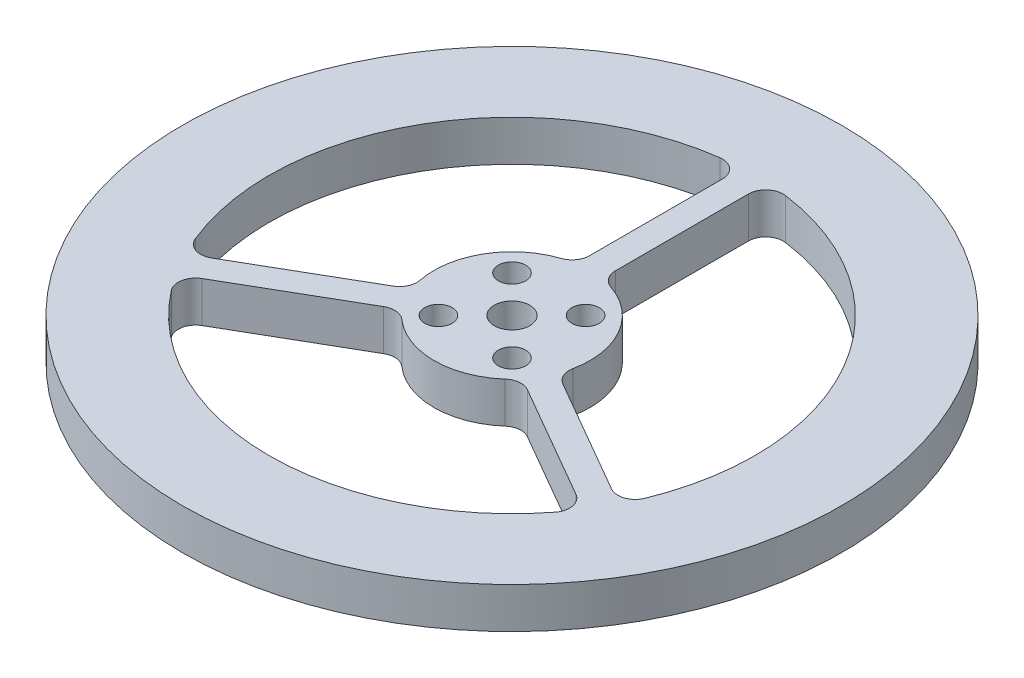
from build123d import *

# Parameters (mm, degrees)
SKETCH1_R           = 38
SKETCH1_R_2         = 28
BOSS_EXTRUDE1_DEPTH = 4.7
SKETCH2_R           = 9
SKETCH2_R_2         = 2.05
SKETCH2_R_3         = 1.575
BOSS_EXTRUDE2_DEPTH = 4.7
SKETCH3_W           = 3
SKETCH3_H           = 20.125880325
BOSS_EXTRUDE3_DEPTH = 4.7
FILLET1_R           = 2
FILLET2_R           = 2


with BuildPart() as part:
    # Sketch1 → Boss-Extrude1 (new body)
    with BuildSketch(Plane(origin=(0, 0, 0), x_dir=(1, 0, 0), z_dir=(0, 1, 0))):
        with Locations(Location((0, 0, 0), (0, 0, 270))):
            Circle(SKETCH1_R)
        with Locations(Location((0, 0, 0), (0, 0, 270))):
            Circle(SKETCH1_R_2, mode=Mode.SUBTRACT)
    extrude(amount=BOSS_EXTRUDE1_DEPTH)



with BuildPart() as body_2:
    # Sketch2 → Boss-Extrude2 (new body)
    with BuildSketch(Plane(origin=(0, 0, 0), x_dir=(1, 0, 0), z_dir=(0, 1, 0))):
        with Locations(Location((0, 0, 0), (0, 0, 270))):
            Circle(SKETCH2_R)
        with Locations(Location((0, 0, 0), (0, 0, 270))):
            Circle(SKETCH2_R_2, mode=Mode.SUBTRACT)
        with Locations(Location((-4.242640687, 4.242640687, 0), (0, 0, 270))):
            Circle(SKETCH2_R_3, mode=Mode.SUBTRACT)
        with Locations(Location((-4.242640687, -4.242640687, 0), (0, 0, 270))):
            Circle(SKETCH2_R_3, mode=Mode.SUBTRACT)
        with Locations(Location((4.242640687, -4.242640687, 0), (0, 0, 270))):
            Circle(SKETCH2_R_3, mode=Mode.SUBTRACT)
        with Locations(Location((4.242640687, 4.242640687, 0), (0, 0, 270))):
            Circle(SKETCH2_R_3, mode=Mode.SUBTRACT)
    extrude(amount=BOSS_EXTRUDE2_DEPTH)


with BuildPart() as part_1:
    add(part.part)

    add(body_2.part)  # Boss-Extrude3 merges body 2
    # Sketch3 → Boss-Extrude3 (add)
    with BuildSketch(Plane(origin=(0, 0, 0), x_dir=(1, 0, 0), z_dir=(0, 1, 0))):
        with Locations((0, 18.937059838)):
            Rectangle(SKETCH3_W, SKETCH3_H)
        Polygon((25.86473671, -13.200961894), (24.36473671, -15.799038106), (6.935213074, -5.736097943), (8.435213074, -3.138021732), align=None)
        Polygon((-24.36473671, -15.799038106), (-25.86473671, -13.200961894), (-8.435213074, -3.138021732), (-6.935213074, -5.736097943), align=None)
    extrude(amount=BOSS_EXTRUDE3_DEPTH)

    # Fillet1
    fillet1_edges = [part_1.edges().sort_by_distance(p)[0] for p in [
        (1.5, 2.35, -27.95979256),
        (-1.5, 2.35, -27.95979256),
        (24.963890642, 2.35, 12.680858174),
        (23.463890642, 2.35, 15.278934386),
        (-23.463890642, 2.35, 15.278934386),
        (-24.963890642, 2.35, 12.680858174),
    ]]
    fillet(fillet1_edges, radius=FILLET1_R)

    # Fillet2
    fillet2_edges = [part_1.edges().sort_by_distance(p)[0] for p in [
        (-1.5, 2.35, -8.874119675),
        (1.5, 2.35, -8.874119675),
        (8.435213074, 2.35, 3.138021732),
        (6.935213074, 2.35, 5.736097943),
        (-6.935213074, 2.35, 5.736097943),
        (-8.435213074, 2.35, 3.138021732),
    ]]
    fillet(fillet2_edges, radius=FILLET2_R)


solid = part_1.part
